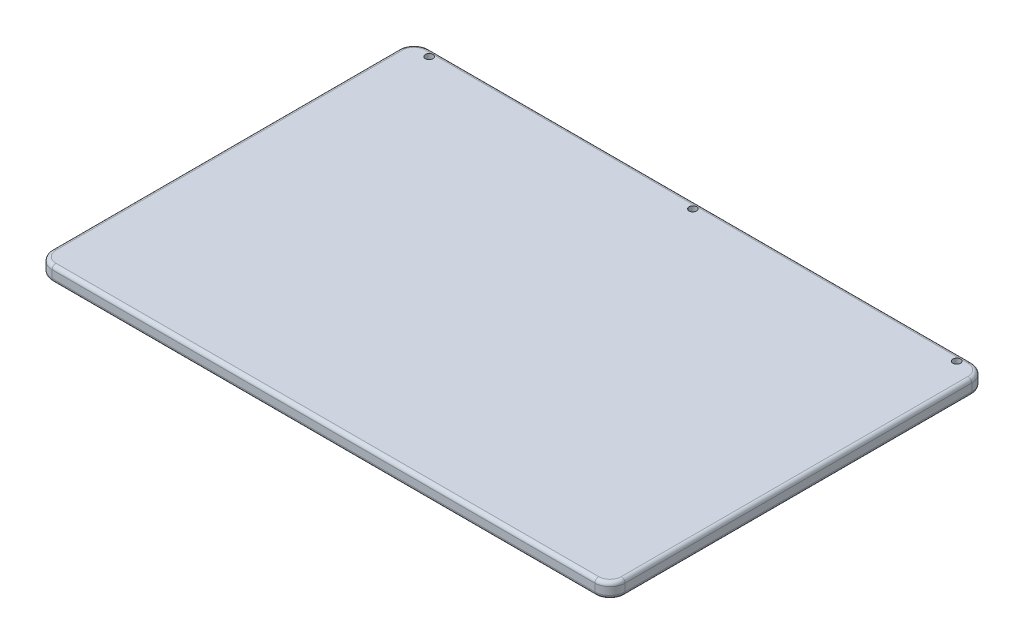
from build123d import *
from OCP.BRepFilletAPI import BRepFilletAPI_MakeFillet

# Parameters (mm, degrees)
SKETCH1_W           = 380
SKETCH1_H           = 250
BOSS_EXTRUDE1_DEPTH = 10
FILLET1_R1          = 10
FILLET1_R2          = 2.5
SKETCH2_R           = 2.5
CUT_EXTRUDE1_DEPTH  = 228.651048895


with BuildPart() as part:
    # Sketch1 → Boss-Extrude1 (new body)
    with BuildSketch(Plane(origin=(0, 0, 0), x_dir=(1, 0, 0), z_dir=(0, 1, 0))):
        Rectangle(SKETCH1_W, SKETCH1_H)
    extrude(amount=BOSS_EXTRUDE1_DEPTH)

    # Fillet1: one fillet with a radius per group of edges: ONE call of the kernel's fillet builder (fillet() takes one radius for all edges)
    fillet1_edges_1 = [part.edges().sort_by_distance(p)[0] for p in [
        (190, 5, 125),
        (-190, 5, 125),
        (-190, 5, -125),
        (190, 5, -125),
    ]]
    fillet1_edges_2 = [part.edges().sort_by_distance(p)[0] for p in [
        (190, 10, 0),
        (190, 0, 0),
        (0, 10, -125),
        (0, 0, -125),
        (-190, 10, 0),
        (-190, 0, 0),
        (0, 10, 125),
        (0, 0, 125),
    ]]
    fillet1 = BRepFilletAPI_MakeFillet(part.part.solid().wrapped)
    for e in fillet1_edges_1:
        fillet1.Add(FILLET1_R1, e.wrapped)
    for e in fillet1_edges_2:
        fillet1.Add(FILLET1_R2, e.wrapped)
    add(Compound.cast(fillet1.Shape()), mode=Mode.REPLACE)

    # Sketch2 → Cut-Extrude1 (cut, through all)
    with BuildSketch(Plane.XZ):
        with Locations((0, -120)):
            Circle(SKETCH2_R)
        with Locations((-175, -120)):
            Circle(SKETCH2_R)
        with Locations((175, -120)):
            Circle(SKETCH2_R)
    extrude(amount=-CUT_EXTRUDE1_DEPTH, mode=Mode.SUBTRACT)


solid = part.part
